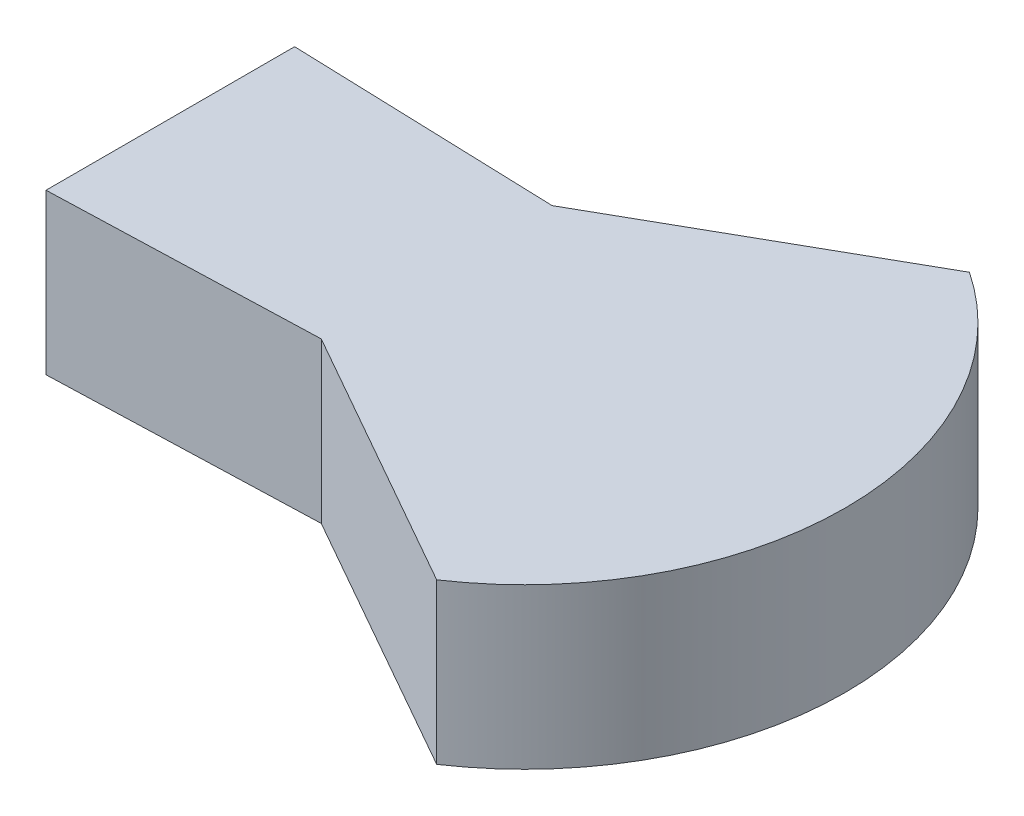
from build123d import *

# Parameters (mm, degrees)
BOSS_EXTRUDE1_DEPTH = 3
CUT_EXTRUDE1_DEPTH  = 1.5
BOSS_EXTRUDE2_DEPTH = 1.5
BOSS_EXTRUDE3_DEPTH = 4.5
BOSS_EXTRUDE4_DEPTH = 4.5


with BuildPart() as part:
    # Sketch1 → Boss-Extrude1 (new body)
    with BuildSketch(Plane(origin=(0, 0, 0), x_dir=(1, 0, 0), z_dir=(0, 1, 0))):
        Polygon((-7.5, 3.5), (-7.5, -3.5), (7.5, -3), (7.5, 3), align=None)
    extrude(amount=BOSS_EXTRUDE1_DEPTH)

    # Sketch2 → Cut-Extrude1 (cut)
    with BuildSketch(Plane.XZ):
        with BuildLine():
            Line((-7.5, 2.375), (-7.5, -2.375))
            Line((-7.5, -2.375), (-0.032313986, -2.025))
            ThreePointArc((-0.032313986, -2.025), (1.9, 0), (-0.032313986, 2.025))
            Line((-0.032313986, 2.025), (-7.5, 2.375))
        make_face()
    extrude(amount=-CUT_EXTRUDE1_DEPTH, mode=Mode.SUBTRACT)

    # Sketch4 → Boss-Extrude2 (add)
    with BuildSketch(Plane.XZ):
        Polygon((-7.5, -3.5), (7.5, -3), (7.5, 3), (-7.5, 3.5), align=None)
    extrude(amount=BOSS_EXTRUDE2_DEPTH)

    # Sketch6 → Boss-Extrude3 (add)
    with BuildSketch(Plane(origin=(0, 3, 0), x_dir=(1, 0, 0), z_dir=(0, 1, 0))):
        with BuildLine():
            Line((7.5, 7.5), (7.5, -7.5))
            ThreePointArc((7.5, -7.5), (11.5, 0), (7.5, 7.5))
        make_face()
    extrude(amount=-BOSS_EXTRUDE3_DEPTH)

    # Sketch7 → Boss-Extrude4 (add)
    with BuildSketch(Plane.XZ.offset(1.5)):
        Polygon((7.5, 7.5), (0, 3.25), (7.5, 3), align=None)
    boss_extrude4 = extrude(amount=-BOSS_EXTRUDE4_DEPTH)

    # Mirror1: Boss-Extrude4 across plane
    add(boss_extrude4.mirror(Plane.XY))


solid = part.part
